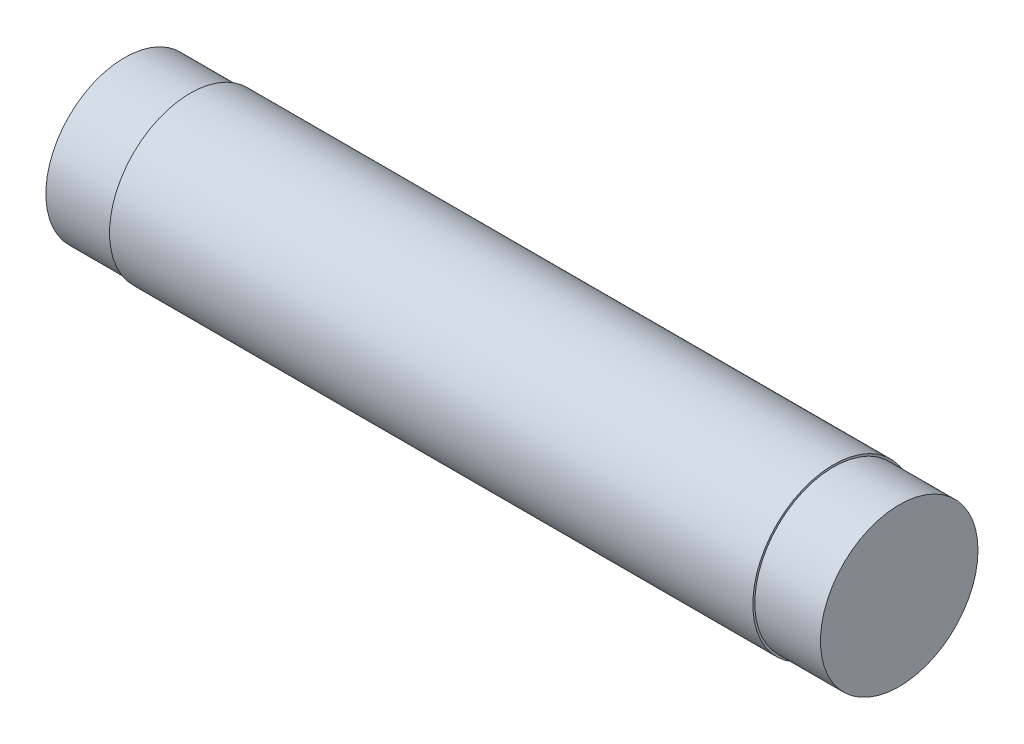
from build123d import *

# Parameters (mm, degrees)
SKETCH1_R           = 6.15
BOSS_EXTRUDE1_DEPTH = 59
CUT_EXTRUDE1_START  = -5
SKETCH2_R           = 6.15
SKETCH2_R_2         = 6
CUT_EXTRUDE1_DEPTH  = 5


with BuildPart() as part:
    # Sketch1 → Boss-Extrude1 (new body)
    with BuildSketch(Plane(origin=(0, 0, 0), x_dir=(0, 0, -1), z_dir=(1, 0, 0))):
        Circle(SKETCH1_R)
    extrude(amount=BOSS_EXTRUDE1_DEPTH)

    # Sketch2 → Cut-Extrude1 (cut)
    with BuildSketch(Plane(origin=(59, 0, 0), x_dir=(0, 0, -1), z_dir=(1, 0, 0)).offset(CUT_EXTRUDE1_START)):
        Circle(SKETCH2_R)
        Circle(SKETCH2_R_2, mode=Mode.SUBTRACT)
    cut_extrude1 = extrude(amount=CUT_EXTRUDE1_DEPTH, mode=Mode.SUBTRACT)

    # Mirror1: Cut-Extrude1 across plane
    add(cut_extrude1.mirror(Plane(origin=(29.5, 0, 0), x_dir=(0, 0, 1), z_dir=(1, 0, 0))), mode=Mode.SUBTRACT)


solid = part.part
